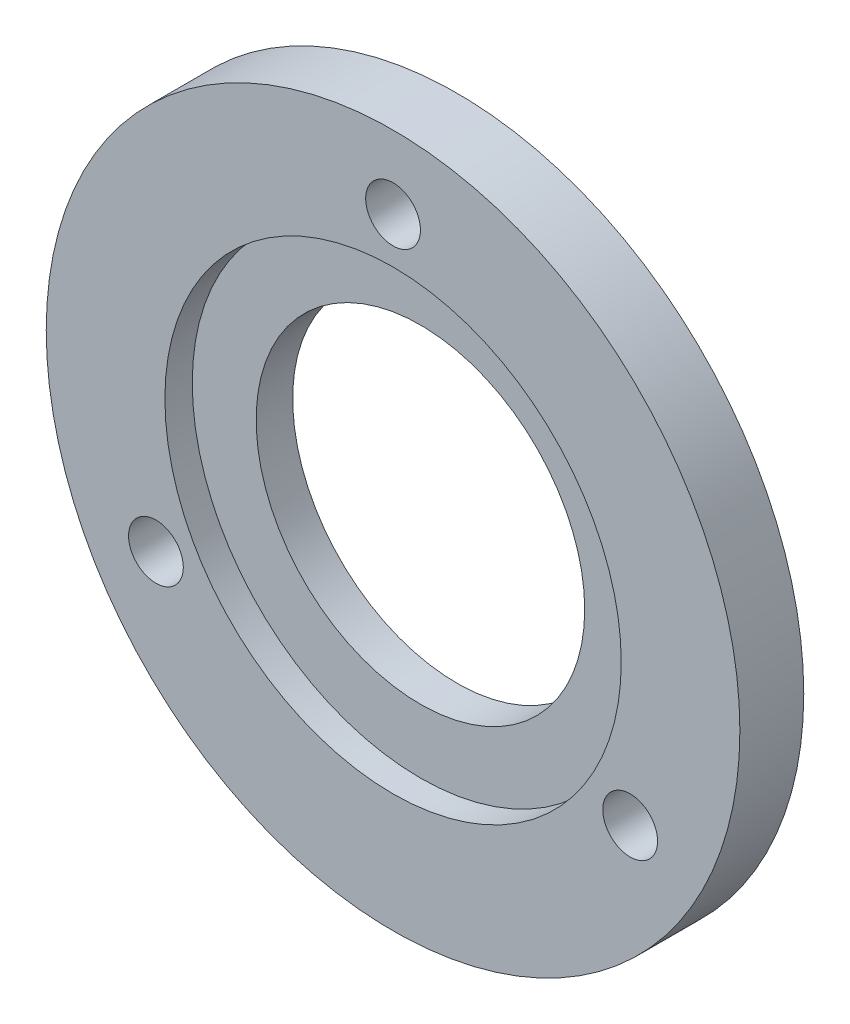
from build123d import *

# Parameters (mm, degrees)
SKETCH1_R               = 19
BOSS_EXTRUDE1_DEPTH     = 2
SKETCH2_R               = 19
SKETCH2_R_2             = 12.5
BOSS_EXTRUDE2_DEPTH     = 1.5
CUT_EXTRUDE1_DEPTH      = 27.944387171
CUT_EXTRUDE1_DEPTH_BACK = 27.944387171
SKETCH3_R               = 9
SKETCH4_R               = 1.5
CUT_EXTRUDE2_DEPTH      = 28.09704781
CIRPATTERN1_COUNT       = 3


with BuildPart() as part:
    # Sketch1 → Boss-Extrude1 (new body)
    with BuildSketch(Plane.XY):
        Circle(SKETCH1_R)
    extrude(amount=BOSS_EXTRUDE1_DEPTH)

    # Sketch2 → Boss-Extrude2 (add)
    with BuildSketch(Plane.XY.offset(2)):
        Circle(SKETCH2_R)
        Circle(SKETCH2_R_2, mode=Mode.SUBTRACT)
    extrude(amount=BOSS_EXTRUDE2_DEPTH)

    # Sketch3 → Cut-Extrude1 (cut, two sides: drawn at the far end of the back side and taken through both)
    with BuildSketch(Plane.XY.offset(2).offset(-CUT_EXTRUDE1_DEPTH_BACK)):
        Circle(SKETCH3_R)
    extrude(amount=CUT_EXTRUDE1_DEPTH + CUT_EXTRUDE1_DEPTH_BACK, mode=Mode.SUBTRACT)

    # Sketch4 → Cut-Extrude2 (cut, symmetric)
    with BuildSketch(Plane.XY):
        with Locations((0, 15)):
            Circle(SKETCH4_R)
    cut_extrude2 = extrude(amount=CUT_EXTRUDE2_DEPTH, both=True, mode=Mode.SUBTRACT)

    # CirPattern1: Cut-Extrude2 ×3 about axis
    cirpattern1_axis = Axis((0, 0, 0), (0, 0, 1))
    for i in range(1, CIRPATTERN1_COUNT):
        add(cut_extrude2.rotate(cirpattern1_axis, i * 360 / CIRPATTERN1_COUNT), mode=Mode.SUBTRACT)


solid = part.part
